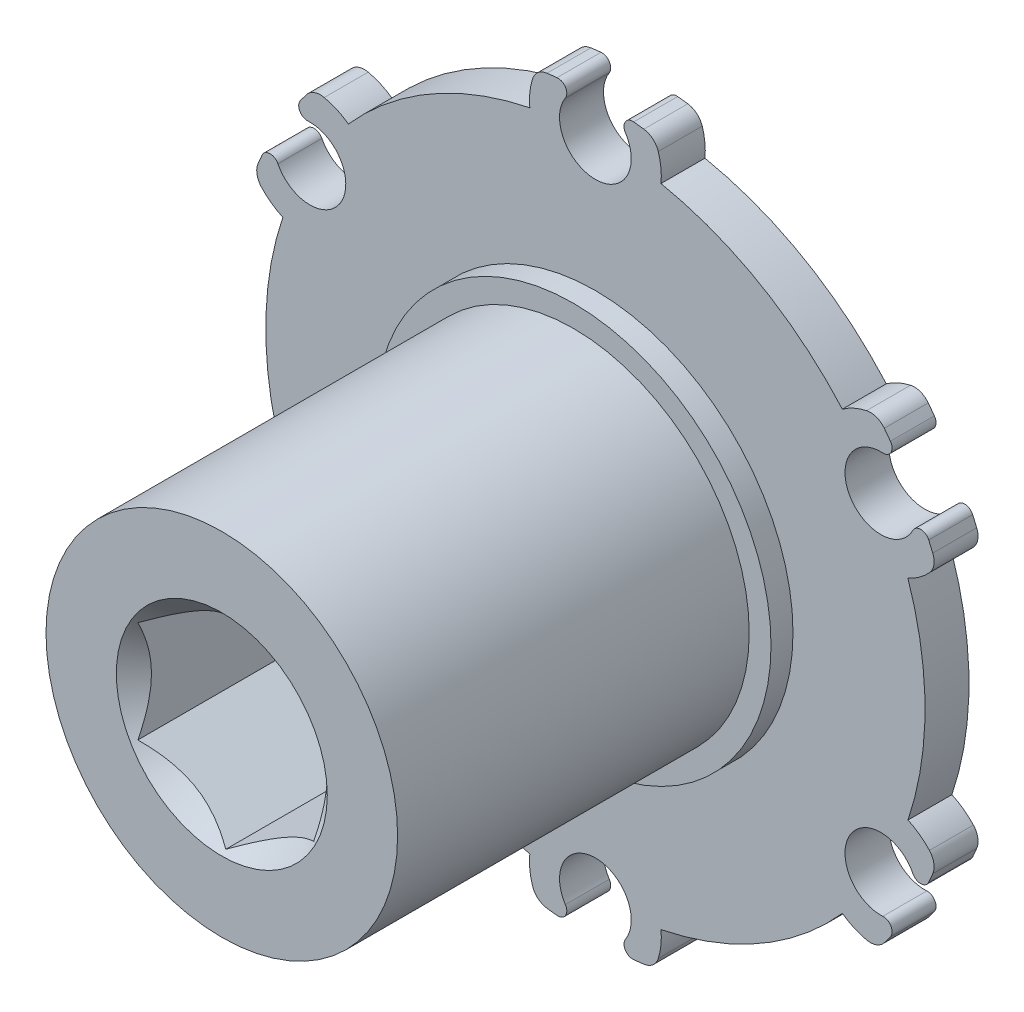
from build123d import *

# Parameters (mm, degrees)
SKETCH1_R           = 6.35
BOSS_EXTRUDE2_DEPTH = 3.175
FILLET1_R           = 0.635
CUT_EXTRUDE2_START  = -3.175
CUT_EXTRUDE2_DEPTH  = 3.175
FILLET2_R           = 1.27
SKETCH3_R           = 14.2748
SKETCH3_R_2         = 6.35
BOSS_EXTRUDE3_DEPTH = 1.5875
SKETCH4_R           = 12.7
SKETCH4_R_2         = 6.35
BOSS_EXTRUDE4_DEPTH = 25.4
CHAMFER1_SIZE       = 1.27
CUT_EXTRUDE3_DEPTH  = 48.891485556


with BuildPart() as part:
    # Sketch1 → Boss-Extrude2 (new body)
    with BuildSketch(Plane.XY):
        with BuildLine():
            ThreePointArc((0.537044489, 26.347027147), (2.012910766, 25.443583961), (2.5908, 23.8125))
            ThreePointArc((2.5908, 23.8125), (-1.631083961, 21.799589234), (-0.537044489, 26.347027147))
            ThreePointArc((-0.537044489, 26.347027147), (-13.17625, 22.821934453), (-22.548672579, 13.638607743))
            ThreePointArc((-22.548672579, 13.638607743), (-19.69454005, 14.325265529), (-18.031429928, 11.90625))
            ThreePointArc((-18.031429928, 11.90625), (-21.028334691, 9.347476161), (-23.085717068, 12.708419403))
            ThreePointArc((-23.085717068, 12.708419403), (-26.3525, 0), (-23.085717068, -12.708419403))
            ThreePointArc((-23.085717068, -12.708419403), (-21.028334691, -9.347476161), (-18.031429928, -11.90625))
            ThreePointArc((-18.031429928, -11.90625), (-19.69454005, -14.325265529), (-22.548672579, -13.638607743))
            ThreePointArc((-22.548672579, -13.638607743), (-13.17625, -22.821934453), (-0.537044489, -26.347027147))
            ThreePointArc((-0.537044489, -26.347027147), (-1.631083961, -21.799589234), (2.5908, -23.8125))
            ThreePointArc((2.5908, -23.8125), (2.012910766, -25.443583961), (0.537044489, -26.347027147))
            ThreePointArc((0.537044489, -26.347027147), (13.17625, -22.821934453), (22.548672579, -13.638607743))
            ThreePointArc((22.548672579, -13.638607743), (18.203214398, -10.978560122), (23.213029928, -11.90625))
            ThreePointArc((23.213029928, -11.90625), (23.181003767, -12.312354763), (23.085717068, -12.708419403))
            ThreePointArc((23.085717068, -12.708419403), (25.52274099, -6.560788719), (26.3525, 0))
            ThreePointArc((26.3525, 0), (25.52274099, 6.560788719), (23.085717068, 12.708419403))
            ThreePointArc((23.085717068, 12.708419403), (23.181003767, 12.312354763), (23.213029928, 11.90625))
            ThreePointArc((23.213029928, 11.90625), (18.203214398, 10.978560122), (22.548672579, 13.638607743))
            ThreePointArc((22.548672579, 13.638607743), (13.17625, 22.821934453), (0.537044489, 26.347027147))
        make_face()
        Circle(SKETCH1_R, mode=Mode.SUBTRACT)
    extrude(amount=BOSS_EXTRUDE2_DEPTH)

    # Fillet1
    fillet1_edges = [part.edges().sort_by_distance(p)[0] for p in [
        (23.085717068, 12.708419403, 1.5875),
        (23.085717068, -12.708419403, 1.5875),
        (22.548672579, -13.638607743, 1.5875),
        (0.537044489, -26.347027147, 1.5875),
        (-0.537044489, -26.347027147, 1.5875),
        (-22.548672579, -13.638607743, 1.5875),
        (-23.085717068, -12.708419403, 1.5875),
        (-23.085717068, 12.708419403, 1.5875),
        (-22.548672579, 13.638607743, 1.5875),
        (-0.537044489, 26.347027147, 1.5875),
        (0.537044489, 26.347027147, 1.5875),
        (22.548672579, 13.638607743, 1.5875),
    ]]
    fillet(fillet1_edges, radius=FILLET1_R)

    # Sketch2 → Cut-Extrude2 (cut)
    with BuildSketch(Plane.XY.offset(3.175).offset(CUT_EXTRUDE2_START)):
        with BuildLine():
            ThreePointArc((-4.738627669, 23.33625), (-4.676871154, 24.711545302), (-4.224316785, 26.011716667))
            ThreePointArc((-4.224316785, 26.011716667), (-13.17625, 22.821934453), (-20.414649037, 16.664223983))
            ThreePointArc((-20.414649037, 16.664223983), (-19.062390421, 16.406061881), (-17.840471494, 15.771896941))
            ThreePointArc((-17.840471494, 15.771896941), (-11.90625, 20.622229928), (-4.738627669, 23.33625))
        make_face()
        with BuildLine():
            ThreePointArc((4.224316785, 26.011716667), (4.625997997, 24.944555113), (4.7625, 23.8125))
            ThreePointArc((4.7625, 23.8125), (4.756528173, 23.574076034), (4.738627669, 23.33625))
            ThreePointArc((4.738627669, 23.33625), (11.90625, 20.622229928), (17.840471494, 15.771896941))
            ThreePointArc((17.840471494, 15.771896941), (19.062390421, 16.406061881), (20.414649037, 16.664223983))
            ThreePointArc((20.414649037, 16.664223983), (13.17625, 22.821934453), (4.224316785, 26.011716667))
        make_face()
        with BuildLine():
            ThreePointArc((24.638965822, 9.347492684), (23.739261575, 8.305483421), (22.579099164, 7.564353059))
            ThreePointArc((22.579099164, 7.564353059), (23.502127085, 3.832124568), (23.8125, 0))
            ThreePointArc((23.8125, 0), (23.502127085, -3.832124568), (22.579099164, -7.564353059))
            ThreePointArc((22.579099164, -7.564353059), (23.739261575, -8.305483421), (24.638965822, -9.347492684))
            ThreePointArc((24.638965822, -9.347492684), (25.920576798, -4.751626533), (26.3525, 0))
            ThreePointArc((26.3525, 0), (25.920576798, 4.751626533), (24.638965822, 9.347492684))
        make_face()
        with BuildLine():
            ThreePointArc((20.414649037, -16.664223983), (19.062390421, -16.406061881), (17.840471494, -15.771896941))
            ThreePointArc((17.840471494, -15.771896941), (11.90625, -20.622229928), (4.738627669, -23.33625))
            ThreePointArc((4.738627669, -23.33625), (4.756528173, -23.574076034), (4.7625, -23.8125))
            ThreePointArc((4.7625, -23.8125), (4.625997997, -24.944555113), (4.224316785, -26.011716667))
            ThreePointArc((4.224316785, -26.011716667), (13.17625, -22.821934453), (20.414649037, -16.664223983))
        make_face()
        with BuildLine():
            ThreePointArc((-17.840471494, -15.771896941), (-19.062390421, -16.406061881), (-20.414649037, -16.664223983))
            ThreePointArc((-20.414649037, -16.664223983), (-13.17625, -22.821934453), (-4.224316785, -26.011716667))
            ThreePointArc((-4.224316785, -26.011716667), (-4.676871154, -24.711545302), (-4.738627669, -23.33625))
            ThreePointArc((-4.738627669, -23.33625), (-11.90625, -20.622229928), (-17.840471494, -15.771896941))
        make_face()
        with BuildLine():
            ThreePointArc((-22.579099164, 7.564353059), (-23.739261575, 8.305483421), (-24.638965822, 9.347492684))
            ThreePointArc((-24.638965822, 9.347492684), (-26.3525, 0), (-24.638965822, -9.347492684))
            ThreePointArc((-24.638965822, -9.347492684), (-23.739261575, -8.305483421), (-22.579099164, -7.564353059))
            ThreePointArc((-22.579099164, -7.564353059), (-23.8125, 0), (-22.579099164, 7.564353059))
        make_face()
    extrude(amount=CUT_EXTRUDE2_DEPTH, mode=Mode.SUBTRACT)

    # Fillet2
    fillet2_edges = [part.edges().sort_by_distance(p)[0] for p in [
        (-24.638965822, -9.347492684, 1.5875),
        (-24.638965822, 9.347492684, 1.5875),
        (-4.224316785, -26.011716667, 1.5875),
        (-20.414649037, -16.664223983, 1.5875),
        (20.414649037, -16.664223983, 1.5875),
        (4.224316785, -26.011716667, 1.5875),
        (24.638965822, 9.347492684, 1.5875),
        (24.638965822, -9.347492684, 1.5875),
        (4.224316785, 26.011716667, 1.5875),
        (20.414649037, 16.664223983, 1.5875),
        (-20.414649037, 16.664223983, 1.5875),
        (-4.224316785, 26.011716667, 1.5875),
    ]]
    fillet(fillet2_edges, radius=FILLET2_R)

    # Sketch3 → Boss-Extrude3 (add)
    with BuildSketch(Plane.XY.offset(3.175)):
        Circle(SKETCH3_R)
        Circle(SKETCH3_R_2, mode=Mode.SUBTRACT)
    boss_extrude3 = extrude(amount=BOSS_EXTRUDE3_DEPTH)

    # Mirror1: Boss-Extrude3 across plane
    add(boss_extrude3.mirror(Plane.XY.offset(1.5875)))

    # Sketch4 → Boss-Extrude4 (add)
    with BuildSketch(Plane.XY.offset(4.7625)):
        Circle(SKETCH4_R)
        Circle(SKETCH4_R_2, mode=Mode.SUBTRACT)
    extrude(amount=BOSS_EXTRUDE4_DEPTH)

    # Chamfer1
    chamfer1_edges = [part.edges().sort_by_distance(p)[0] for p in [
        (-6.35, 0, -1.5875),
        (-6.35, 0, 30.1625),
    ]]
    chamfer(chamfer1_edges, length=CHAMFER1_SIZE)

    # Sketch5 → Cut-Extrude3 (cut, through all)
    with BuildSketch(Plane.XY.offset(30.1625)):
        Polygon((0, 7.332348419), (-6.35, 3.666174209), (-6.35, -3.666174209), (0, -7.332348419), (6.35, -3.666174209), (6.35, 3.666174209), align=None)
    extrude(amount=-CUT_EXTRUDE3_DEPTH, mode=Mode.SUBTRACT)


solid = part.part
